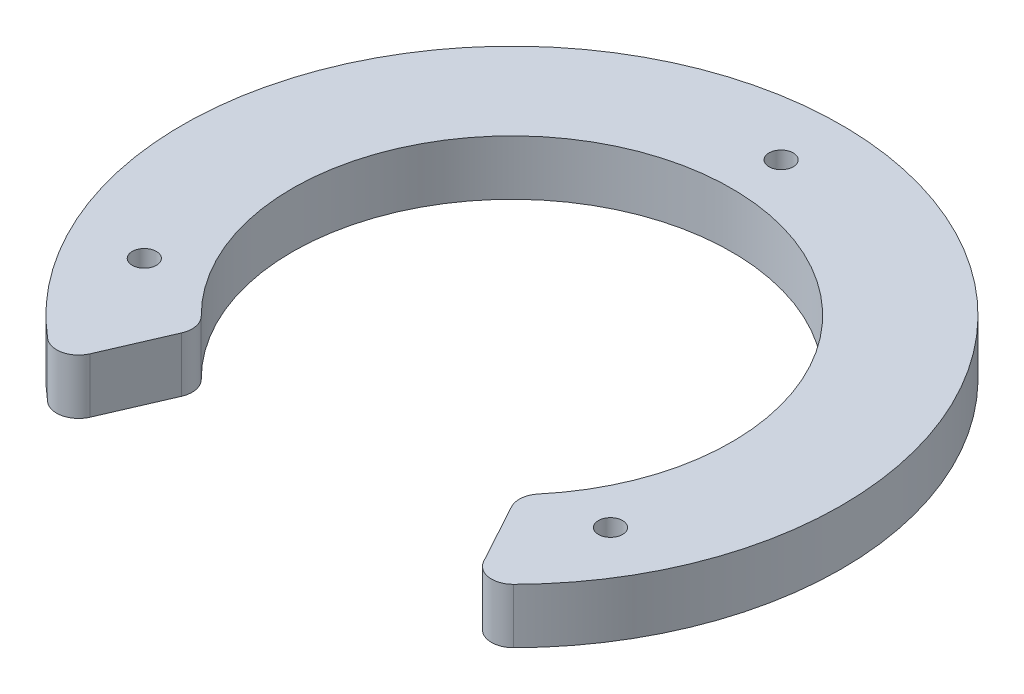
from build123d import *

# Parameters (mm, degrees)
SKETCH_1_R          = 30
SKETCH_1_R_2        = 20
SKETCH_1_R_3        = 1.1
EXTRUDE_1_DEPTH     = 5
CUT_EXTRUDE_START   = -10
CUT_EXTRUDE_1_DEPTH = 10
FILLET_1_R          = 2


with BuildPart() as part:
    # 草图1 → 凸台-拉伸1 (new body)
    with BuildSketch(Plane(origin=(0, 0, 0), x_dir=(1, 0, 0), z_dir=(0, 1, 0))):
        with Locations(Location((0, 0, 0), (0, 0, 270))):
            Circle(SKETCH_1_R)
        with Locations(Location((0, 0, 0), (0, 0, 270))):
            Circle(SKETCH_1_R_2, mode=Mode.SUBTRACT)
        with Locations(Location((0, 24.5, 0), (0, 0, 270))):
            Circle(SKETCH_1_R_3, mode=Mode.SUBTRACT)
        with Locations(Location((21.217622393, -12.25, 0), (0, 0, 270))):
            Circle(SKETCH_1_R_3, mode=Mode.SUBTRACT)
        with Locations(Location((-21.217622393, -12.25, 0), (0, 0, 270))):
            Circle(SKETCH_1_R_3, mode=Mode.SUBTRACT)
    extrude(amount=EXTRUDE_1_DEPTH)

    # 草图2 → 切除-拉伸1 (cut)
    with BuildSketch(Plane(origin=(0, 5, 0), x_dir=(1, 0, 0), z_dir=(0, 1, 0)).offset(CUT_EXTRUDE_START)):
        with BuildLine():
            Line((19.339127693, -22.934649334), (14.401131779, -13.878306939))
            ThreePointArc((14.401131779, -13.878306939), (0.907800118, -19.979386851), (-13.08321747, -15.1271088))
            Line((-13.08321747, -15.1271088), (-17.179578816, -24.593943801))
            ThreePointArc((-17.179578816, -24.593943801), (1.361700176, -29.969080277), (19.339127693, -22.934649334))
        make_face()
    extrude(amount=CUT_EXTRUDE_1_DEPTH, mode=Mode.SUBTRACT)

    # 圆角1
    fillet_1_edges = [part.edges().sort_by_distance(p)[0] for p in [
        (14.401131779, 2.5, 13.878306939),
        (-13.08321747, 2.5, 15.1271088),
        (19.339127693, 2.5, 22.934649334),
        (-17.179578816, 2.5, 24.593943801),
    ]]
    fillet(fillet_1_edges, radius=FILLET_1_R)


solid = part.part
